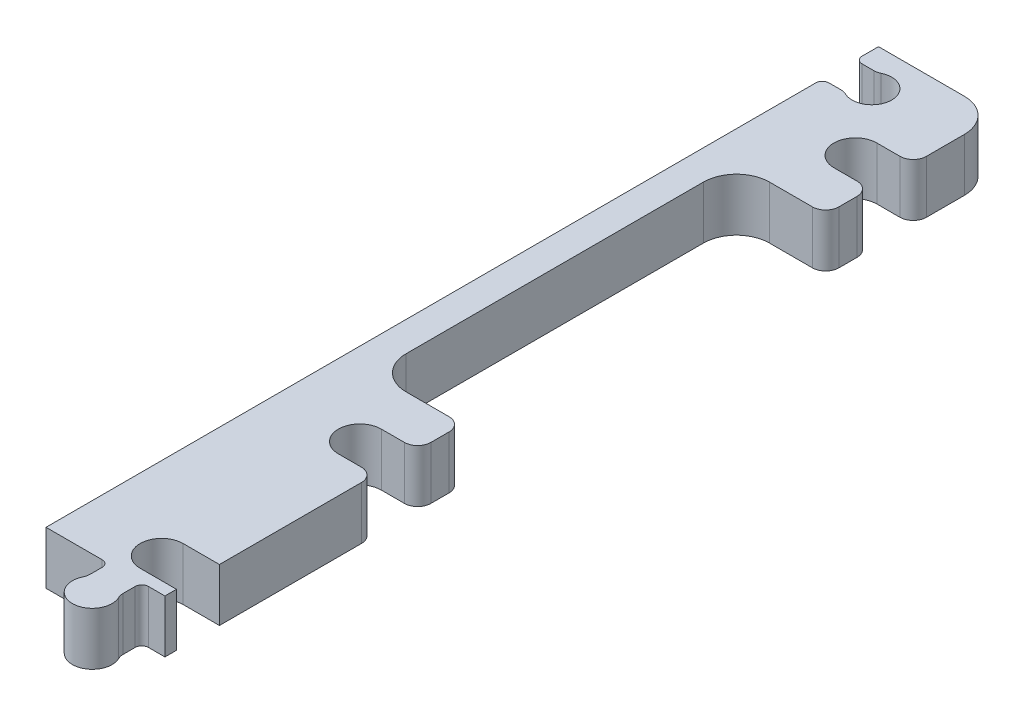
from build123d import *

# Parameters (mm, degrees)
SKETCH_1_W          = 18
SKETCH_1_H          = 126
EXTRUDE_1_DEPTH     = 8
SKETCH_5_W          = 13.5
SKETCH_5_H          = 55
CUT_EXTRUDE_3_DEPTH = 10
CUT_EXTRUDE_1_DEPTH = 10
FILLET_1_R          = 5
FILLET_2_R          = 5
FILLET_3_R          = 2
CUT_EXTRUDE_4_DEPTH = 8
EXTRUDE_3_DEPTH     = 8
FILLET_4_R          = 1


with BuildPart() as part:
    # 스케치1 → 보스-돌출1 (new body)
    with BuildSketch(Plane(origin=(0, 0, 0), x_dir=(1, 0, 0), z_dir=(0, 1, 0))):
        with Locations((9, 63)):
            Rectangle(SKETCH_1_W, SKETCH_1_H)
    extrude(amount=EXTRUDE_1_DEPTH)

    # 스케치5 → 컷-돌출3 (cut)
    with BuildSketch(Plane(origin=(0, 8, 0), x_dir=(1, 0, 0), z_dir=(0, 1, 0))):
        with Locations((11.25, 72.5)):
            Rectangle(SKETCH_5_W, SKETCH_5_H)
    extrude(amount=-CUT_EXTRUDE_3_DEPTH, mode=Mode.SUBTRACT)

    # 스케치2 → 컷-돌출1 (cut)
    with BuildSketch(Plane(origin=(0, 8, 0), x_dir=(1, 0, 0), z_dir=(0, 1, 0))):
        with BuildLine():
            Line((12.5, 8.25), (18, 8.25))
            ThreePointArc((18, 8.25), (21.25, 5), (18, 1.75))
            Line((18, 1.75), (12.5, 1.75))
            ThreePointArc((12.5, 1.75), (9.25, 5), (12.5, 8.25))
        make_face()
        with BuildLine():
            Line((12.5, 113.25), (18, 113.25))
            ThreePointArc((18, 113.25), (21.25, 110), (18, 106.75))
            Line((18, 106.75), (12.5, 106.75))
            ThreePointArc((12.5, 106.75), (9.25, 110), (12.5, 113.25))
        make_face()
        with BuildLine():
            Line((12.5, 38.25), (18, 38.25))
            ThreePointArc((18, 38.25), (21.25, 35), (18, 31.75))
            Line((18, 31.75), (12.5, 31.75))
            ThreePointArc((12.5, 31.75), (9.25, 35), (12.5, 38.25))
        make_face()
    extrude(amount=-CUT_EXTRUDE_1_DEPTH, mode=Mode.SUBTRACT)

    # 필렛1
    fillet_1_edges = [part.edges().sort_by_distance(p)[0] for p in [
        (4.5, 4, -45),
        (4.5, 4, -100),
    ]]
    fillet(fillet_1_edges, radius=FILLET_1_R)

    # 필렛2
    fillet_2_edges = [part.edges().sort_by_distance(p)[0] for p in [
        (18, 4, -126),
    ]]
    fillet(fillet_2_edges, radius=FILLET_2_R)

    # 필렛3
    fillet_3_edges = [part.edges().sort_by_distance(p)[0] for p in [
        (18, 4, -100),
        (18, 4, -45),
        (18, 4, -113.25),
        (18, 4, -106.75),
        (18, 4, -38.25),
        (18, 4, -31.75),
    ]]
    fillet(fillet_3_edges, radius=FILLET_3_R)

    # 스케치6 → 컷-돌출4 (cut)
    with BuildSketch(Plane.XZ):
        with BuildLine():
            Line((0, -117.5), (2.820550528, -117.5))
            ThreePointArc((2.820550528, -117.5), (3.267764124, -117.449358869), (3.692330317, -117.3))
            ThreePointArc((3.692330317, -117.3), (8, -120), (3.692330317, -122.7))
            ThreePointArc((3.692330317, -122.7), (3.267764124, -122.550641131), (2.820550528, -122.5))
            Line((2.820550528, -122.5), (0, -122.5))
            Line((0, -122.5), (0, -117.5))
        make_face()
    extrude(amount=-CUT_EXTRUDE_4_DEPTH, mode=Mode.SUBTRACT)

    # 스케치7 → 보스-돌출3 (add)
    with BuildSketch(Plane.XZ):
        with BuildLine():
            Line((9.5, 0), (9.5, 2.820550528))
            ThreePointArc((9.5, 2.820550528), (9.449358869, 3.267764124), (9.3, 3.692330317))
            ThreePointArc((9.3, 3.692330317), (12, 8), (14.7, 3.692330317))
            ThreePointArc((14.7, 3.692330317), (14.550641131, 3.267764124), (14.5, 2.820550528))
            Line((14.5, 2.820550528), (14.5, 0))
            Line((14.5, 0), (9.5, 0))
        make_face()
    extrude(amount=-EXTRUDE_3_DEPTH)

    # 필렛4
    fillet_4_edges = [part.edges().sort_by_distance(p)[0] for p in [
        (0, 4, -117.5),
        (0, 4, -122.5),
        (9.5, 4, 0),
        (14.5, 4, 0),
    ]]
    fillet(fillet_4_edges, radius=FILLET_4_R)


solid = part.part
